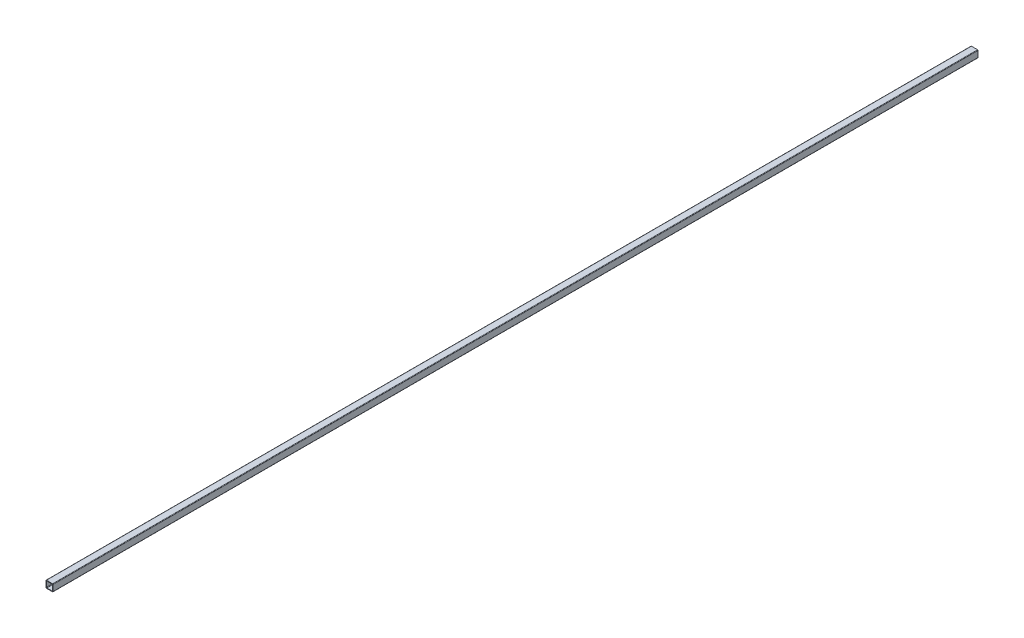
from build123d import *

# Parameters (mm, degrees)
BOSS_EXTRUDE1_DEPTH = 5020


with BuildPart() as part:
    # Sketch1 → Boss-Extrude1 (new body)
    with BuildSketch(Plane.XY):
        with BuildLine():
            Line((2.54, 0), (35.56, 0))
            ThreePointArc((35.56, 0), (37.356051224, -0.743948776), (38.1, -2.54))
            Line((38.1, -2.54), (38.1, -35.56))
            ThreePointArc((38.1, -35.56), (37.356051224, -37.356051224), (35.56, -38.1))
            Line((35.56, -38.1), (2.54, -38.1))
            ThreePointArc((2.54, -38.1), (0.743948776, -37.356051224), (0, -35.56))
            Line((0, -35.56), (0, -2.54))
            ThreePointArc((0, -2.54), (0.743948776, -0.743948776), (2.54, 0))
        make_face()
        with BuildLine():
            Line((5.3086, -2.7686), (32.7914, -2.7686))
            ThreePointArc((32.7914, -2.7686), (34.587451224, -3.512548776), (35.3314, -5.3086))
            Line((35.3314, -5.3086), (35.3314, -32.7914))
            ThreePointArc((35.3314, -32.7914), (34.587451224, -34.587451224), (32.7914, -35.3314))
            Line((32.7914, -35.3314), (5.3086, -35.3314))
            ThreePointArc((5.3086, -35.3314), (3.512548776, -34.587451224), (2.7686, -32.7914))
            Line((2.7686, -32.7914), (2.7686, -5.3086))
            ThreePointArc((2.7686, -5.3086), (3.512548776, -3.512548776), (5.3086, -2.7686))
        make_face(mode=Mode.SUBTRACT)
    extrude(amount=BOSS_EXTRUDE1_DEPTH)


solid = part.part
